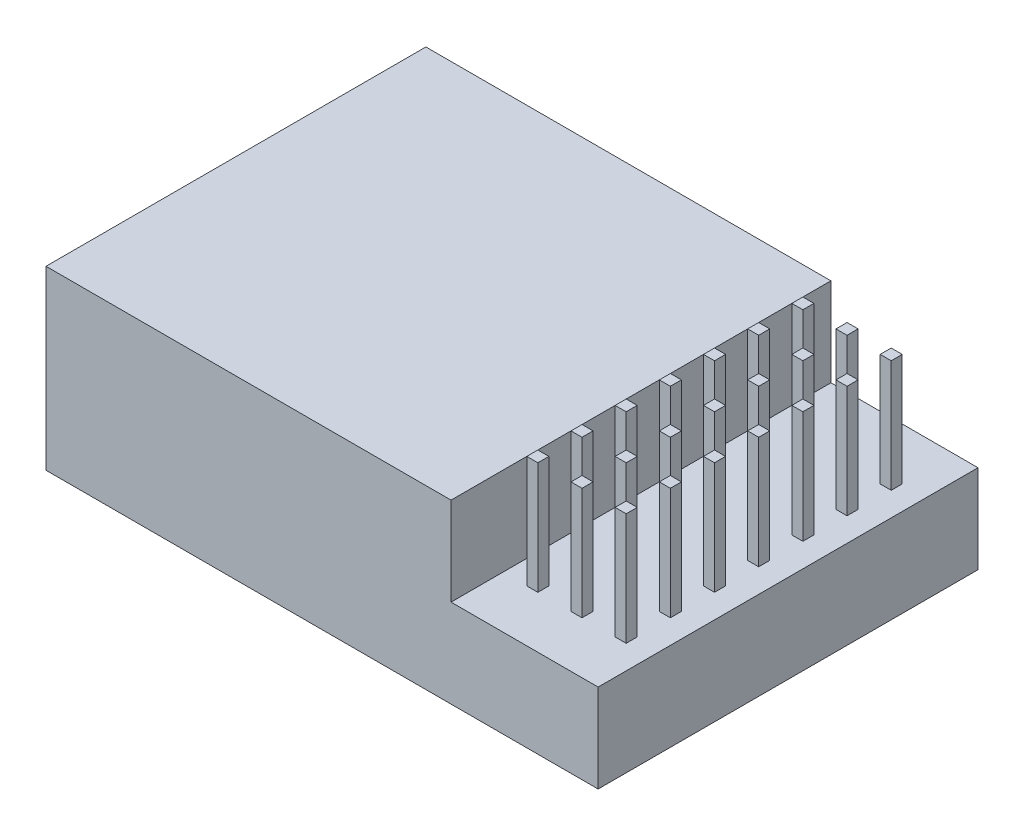
from build123d import *

# Parameters (mm, degrees)
SKETCH1_W            = 31.75
SKETCH1_H            = 21.844
BOSS_EXTRUDE1_DEPTH  = 10.16
SKETCH2_W            = 8.4582
SKETCH2_H            = 21.844
CUT_EXTRUDE1_DEPTH   = 5.08
SKETCH3_W            = 0.635
SKETCH3_H            = 0.635
PINS_DEPTH           = 6.4516
PINS_2_DEPTH         = 6.4516
PINS_3_DEPTH         = 6.4516
LPATTERN1_COUNT      = 4
LPATTERN1_PITCH      = 2.54
LPATTERN1_COUNT_DIR2 = 4
LPATTERN1_PITCH_DIR2 = 2.54


with BuildPart() as part:
    # Sketch1 → Boss-Extrude1 (new body)
    with BuildSketch(Plane(origin=(0, 0, 0), x_dir=(1, 0, 0), z_dir=(0, 1, 0))):
        Rectangle(SKETCH1_W, SKETCH1_H)
    extrude(amount=BOSS_EXTRUDE1_DEPTH)

    # Sketch2 → Cut-Extrude1 (cut)
    with BuildSketch(Plane(origin=(0, 10.16, 0), x_dir=(1, 0, 0), z_dir=(0, 1, 0))):
        with Locations((11.6459, 0)):
            Rectangle(SKETCH2_W, SKETCH2_H)
    extrude(amount=-CUT_EXTRUDE1_DEPTH, mode=Mode.SUBTRACT)


with BuildPart() as body_2:
    # Sketch3 → Pins (new body)
    with BuildSketch(Plane(origin=(0, 5.08, 0), x_dir=(1, 0, 0), z_dir=(0, 1, 0))):
        with Locations((14.1859, 0)):
            Rectangle(SKETCH3_W, SKETCH3_H)
    pins = extrude(amount=PINS_DEPTH)


with BuildPart() as body_3:
    # Sketch3 → Pins 2 (new body)
    with BuildSketch(Plane(origin=(0, 5.08, 0), x_dir=(1, 0, 0), z_dir=(0, 1, 0))):
        with Locations((11.6459, 0)):
            Rectangle(SKETCH3_W, SKETCH3_H)
    pins_2 = extrude(amount=PINS_2_DEPTH)


with BuildPart() as body_4:
    # Sketch3 → Pins 3 (new body)
    with BuildSketch(Plane(origin=(0, 5.08, 0), x_dir=(1, 0, 0), z_dir=(0, 1, 0))):
        with Locations((9.1059, 0)):
            Rectangle(SKETCH3_W, SKETCH3_H)
    pins_3 = extrude(amount=PINS_3_DEPTH)


with BuildPart() as part_1:
    add(part.part)

    # LPattern1: Pins, Pins 2, Pins 3 4 × 4
    with Locations(*[Vector(0, 0, -1) * (i * LPATTERN1_PITCH) + Vector(0, 0, 1) * (j * LPATTERN1_PITCH_DIR2) for i in range(LPATTERN1_COUNT) for j in range(LPATTERN1_COUNT_DIR2) if (i, j) != (0, 0)]):
        add(pins)
        add(pins_2)
        add(pins_3)


solid = Compound([body_2.part, body_3.part, body_4.part, part_1.part])
